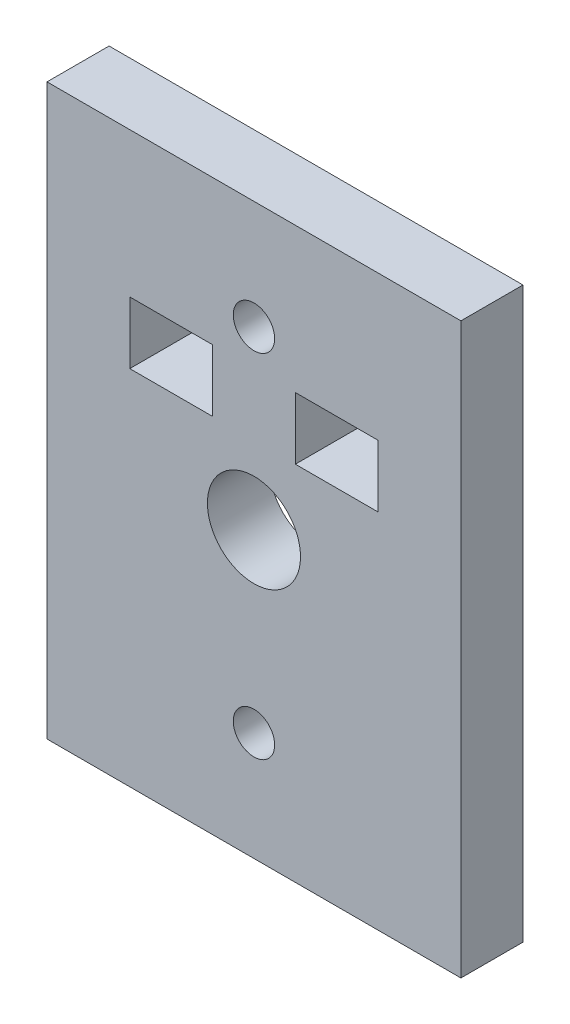
from build123d import *

# Parameters (mm, degrees)
CROQUIS1_W              = 20
CROQUIS1_H              = 27.5
CROQUIS1_R              = 2.25
CROQUIS1_R_2            = 1
CROQUIS1_W_2            = 4
CROQUIS1_H_2            = 3
SALIENTE_EXTRUIR1_DEPTH = 3


with BuildPart() as part:
    # Croquis1 → Saliente-Extruir1 (new body)
    with BuildSketch(Plane.XY):
        Rectangle(CROQUIS1_W, CROQUIS1_H)
        Circle(CROQUIS1_R, mode=Mode.SUBTRACT)
        with Locations((0, 8.5)):
            Circle(CROQUIS1_R_2, mode=Mode.SUBTRACT)
        with Locations((0, -8.5)):
            Circle(CROQUIS1_R_2, mode=Mode.SUBTRACT)
        with Locations((4, 5.25)):
            Rectangle(CROQUIS1_W_2, CROQUIS1_H_2, mode=Mode.SUBTRACT)
        with Locations((-4, 5.25)):
            Rectangle(CROQUIS1_W_2, CROQUIS1_H_2, mode=Mode.SUBTRACT)
    extrude(amount=SALIENTE_EXTRUIR1_DEPTH)


solid = part.part
